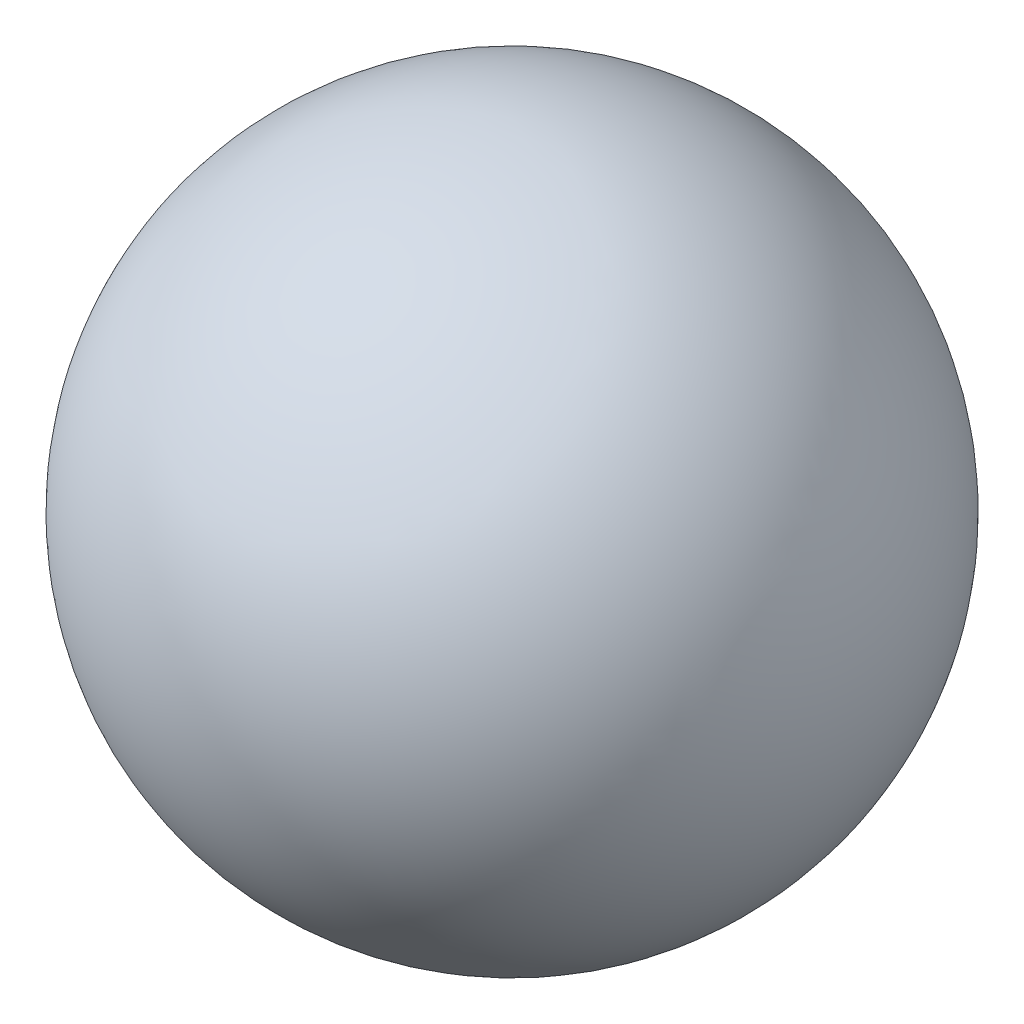
from build123d import *


with BuildPart() as part:
    # 草图1 → 旋转6 (revolve)
    with BuildSketch(Plane.XY):
        with BuildLine():
            Line((18, 0), (-18, 0))
            ThreePointArc((-18, 0), (0, 18), (18, 0))
        make_face()
    revolve(axis=Axis((18, 0, 0), (-1, 0, 0)))


solid = part.part
